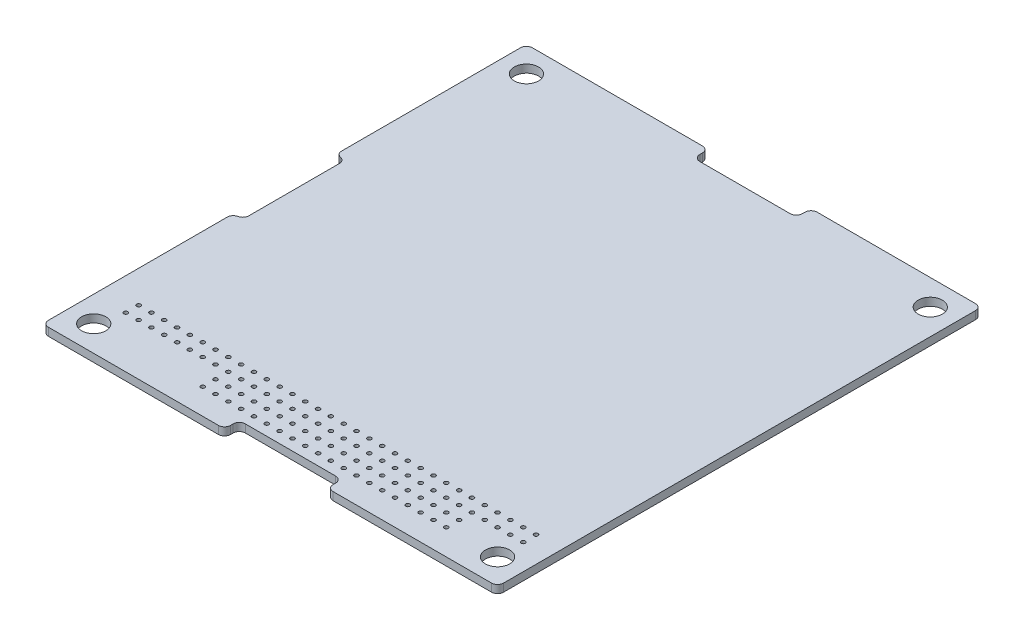
from build123d import *

# Parameters (mm, degrees)
SKETCH1_W           = 90.17
SKETCH1_H           = 95.89
BOSS_EXTRUDE1_DEPTH = 1.57
SKETCH2_W           = 20.32
SKETCH2_H           = 2.93
SKETCH2_W_2         = 1.92
SKETCH2_H_2         = 20.27
SKETCH2_H_3         = 2.92
CUT_EXTRUDE1_DEPTH  = 1.57
SKETCH3_R           = 2.4
CUT_EXTRUDE2_DEPTH  = 1.57
FILLET7_R           = 1.2
FILLET8_R           = 1.2
FILLET9_R           = 1.2
FILLET10_R          = 1.2
FILLET11_R          = 1.2
FILLET12_R          = 1.2
FILLET13_R          = 1.2
FILLET14_R          = 1.2
FILLET17_R          = 1.2
FILLET18_R          = 1.2
FILLET19_R          = 1.2
FILLET20_R          = 1.2
FILLET21_R          = 1.2
SKETCH11_R          = 0.4
CUT_EXTRUDE8_DEPTH  = 10
SKETCH12_R          = 0.4
CUT_EXTRUDE9_DEPTH  = 10
SKETCH13_R          = 0.4
CUT_EXTRUDE10_DEPTH = 10
SKETCH14_R          = 0.4
CUT_EXTRUDE11_DEPTH = 10


with BuildPart() as part:
    # Sketch1 → Boss-Extrude1 (new body)
    with BuildSketch(Plane(origin=(0, 0, 0), x_dir=(1, 0, 0), z_dir=(0, 1, 0))):
        Rectangle(SKETCH1_W, SKETCH1_H)
    extrude(amount=BOSS_EXTRUDE1_DEPTH)

    # Sketch2 → Cut-Extrude1 (cut)
    with BuildSketch(Plane(origin=(0, 1.57, 0), x_dir=(1, 0, 0), z_dir=(0, 1, 0))):
        with Locations((1.145, 46.48)):
            Rectangle(SKETCH2_W, SKETCH2_H)
        with Locations((-44.125, 0)):
            Rectangle(SKETCH2_W_2, SKETCH2_H_2)
        with Locations((1.145, -46.485)):
            Rectangle(SKETCH2_W, SKETCH2_H_3)
    extrude(amount=-CUT_EXTRUDE1_DEPTH, mode=Mode.SUBTRACT)

    # Sketch3 → Cut-Extrude2 (cut)
    with BuildSketch(Plane(origin=(0, 1.57, 0), x_dir=(1, 0, 0), z_dir=(0, 1, 0))):
        with Locations(Location((-40.005, -42.865, 0), (0, 0, 270))):
            Circle(SKETCH3_R)
        with Locations(Location((40.005, -42.865, 0), (0, 0, 270))):
            Circle(SKETCH3_R)
        with Locations(Location((-40.005, 42.865, 0), (0, 0, 270))):
            Circle(SKETCH3_R)
        with Locations(Location((40.005, 42.865, 0), (0, 0, 270))):
            Circle(SKETCH3_R)
    extrude(amount=-CUT_EXTRUDE2_DEPTH, mode=Mode.SUBTRACT)

    # Fillet7
    fillet7_edges = [part.edges().sort_by_distance(p)[0] for p in [
        (-9.015, 0.785, 45.025),
    ]]
    fillet(fillet7_edges, radius=FILLET7_R)

    # Fillet8
    fillet8_edges = [part.edges().sort_by_distance(p)[0] for p in [
        (-9.015, 0.785, 47.945),
    ]]
    fillet(fillet8_edges, radius=FILLET8_R)

    # Fillet9
    fillet9_edges = [part.edges().sort_by_distance(p)[0] for p in [
        (11.305, 0.785, 45.025),
        (11.305, 0.785, 47.945),
    ]]
    fillet(fillet9_edges, radius=FILLET9_R)

    # Fillet10
    fillet10_edges = [part.edges().sort_by_distance(p)[0] for p in [
        (45.085, 0.785, 47.945),
    ]]
    fillet(fillet10_edges, radius=FILLET10_R)

    # Fillet11
    fillet11_edges = [part.edges().sort_by_distance(p)[0] for p in [
        (45.085, 0.785, -47.945),
    ]]
    fillet(fillet11_edges, radius=FILLET11_R)

    # Fillet12
    fillet12_edges = [part.edges().sort_by_distance(p)[0] for p in [
        (11.305, 0.785, -47.945),
        (11.305, 0.785, -45.015),
    ]]
    fillet(fillet12_edges, radius=FILLET12_R)

    # Fillet13
    fillet13_edges = [part.edges().sort_by_distance(p)[0] for p in [
        (-9.015, 0.785, -45.015),
        (-9.015, 0.785, -47.945),
    ]]
    fillet(fillet13_edges, radius=FILLET13_R)

    # Fillet14
    fillet14_edges = [part.edges().sort_by_distance(p)[0] for p in [
        (-45.085, 0.785, -47.945),
    ]]
    fillet(fillet14_edges, radius=FILLET14_R)

    # Fillet17
    fillet17_edges = [part.edges().sort_by_distance(p)[0] for p in [
        (-45.085, 0.785, -10.135),
    ]]
    fillet(fillet17_edges, radius=FILLET17_R)

    # Fillet18
    fillet18_edges = [part.edges().sort_by_distance(p)[0] for p in [
        (-43.165, 0.785, -10.135),
    ]]
    fillet(fillet18_edges, radius=FILLET18_R)

    # Fillet19
    fillet19_edges = [part.edges().sort_by_distance(p)[0] for p in [
        (-45.085, 0.785, 10.135),
    ]]
    fillet(fillet19_edges, radius=FILLET19_R)

    # Fillet20
    fillet20_edges = [part.edges().sort_by_distance(p)[0] for p in [
        (-43.165, 0.785, 10.135),
    ]]
    fillet(fillet20_edges, radius=FILLET20_R)

    # Fillet21
    fillet21_edges = [part.edges().sort_by_distance(p)[0] for p in [
        (-45.085, 0.785, 47.945),
    ]]
    fillet(fillet21_edges, radius=FILLET21_R)

    # Sketch11 → Cut-Extrude8 (cut)
    with BuildSketch(Plane(origin=(0, 1.57, 0), x_dir=(1, 0, 0), z_dir=(0, 1, 0))):
        with Locations(Location((-38.735, -37.785, 0), (0, 0, 270))):
            Circle(SKETCH11_R)
        with Locations(Location((-36.195, -37.785, 0), (0, 0, 270))):
            Circle(SKETCH11_R)
        with Locations(Location((-33.655, -37.785, 0), (0, 0, 270))):
            Circle(SKETCH11_R)
        with Locations(Location((-31.115, -37.785, 0), (0, 0, 270))):
            Circle(SKETCH11_R)
        with Locations(Location((-28.575, -37.785, 0), (0, 0, 270))):
            Circle(SKETCH11_R)
        with Locations(Location((-26.035, -37.785, 0), (0, 0, 270))):
            Circle(SKETCH11_R)
        with Locations(Location((-23.495, -37.785, 0), (0, 0, 270))):
            Circle(SKETCH11_R)
        with Locations(Location((-20.955, -37.785, 0), (0, 0, 270))):
            Circle(SKETCH11_R)
        with Locations(Location((-18.415, -37.785, 0), (0, 0, 270))):
            Circle(SKETCH11_R)
        with Locations(Location((-15.875, -37.785, 0), (0, 0, 270))):
            Circle(SKETCH11_R)
        with Locations(Location((-13.335, -37.785, 0), (0, 0, 270))):
            Circle(SKETCH11_R)
        with Locations(Location((-10.795, -37.785, 0), (0, 0, 270))):
            Circle(SKETCH11_R)
        with Locations(Location((-8.255, -37.785, 0), (0, 0, 270))):
            Circle(SKETCH11_R)
        with Locations(Location((-5.715, -37.785, 0), (0, 0, 270))):
            Circle(SKETCH11_R)
        with Locations(Location((-3.175, -37.785, 0), (0, 0, 270))):
            Circle(SKETCH11_R)
        with Locations(Location((-0.635, -37.785, 0), (0, 0, 270))):
            Circle(SKETCH11_R)
        with Locations(Location((1.905, -37.785, 0), (0, 0, 270))):
            Circle(SKETCH11_R)
        with Locations(Location((4.445, -37.785, 0), (0, 0, 270))):
            Circle(SKETCH11_R)
        with Locations(Location((6.985, -37.785, 0), (0, 0, 270))):
            Circle(SKETCH11_R)
        with Locations(Location((9.525, -37.785, 0), (0, 0, 270))):
            Circle(SKETCH11_R)
        with Locations(Location((12.065, -37.785, 0), (0, 0, 270))):
            Circle(SKETCH11_R)
        with Locations(Location((14.605, -37.785, 0), (0, 0, 270))):
            Circle(SKETCH11_R)
        with Locations(Location((17.145, -37.785, 0), (0, 0, 270))):
            Circle(SKETCH11_R)
        with Locations(Location((19.685, -37.785, 0), (0, 0, 270))):
            Circle(SKETCH11_R)
        with Locations(Location((22.225, -37.785, 0), (0, 0, 270))):
            Circle(SKETCH11_R)
        with Locations(Location((24.765, -37.785, 0), (0, 0, 270))):
            Circle(SKETCH11_R)
        with Locations(Location((27.305, -37.785, 0), (0, 0, 270))):
            Circle(SKETCH11_R)
        with Locations(Location((29.845, -37.785, 0), (0, 0, 270))):
            Circle(SKETCH11_R)
        with Locations(Location((32.385, -37.785, 0), (0, 0, 270))):
            Circle(SKETCH11_R)
        with Locations(Location((34.925, -37.785, 0), (0, 0, 270))):
            Circle(SKETCH11_R)
        with Locations(Location((37.465, -37.785, 0), (0, 0, 270))):
            Circle(SKETCH11_R)
        with Locations(Location((40.005, -37.785, 0), (0, 0, 270))):
            Circle(SKETCH11_R)
    extrude(amount=-CUT_EXTRUDE8_DEPTH, mode=Mode.SUBTRACT)

    # Sketch12 → Cut-Extrude9 (cut)
    with BuildSketch(Plane(origin=(0, 1.57, 0), x_dir=(1, 0, 0), z_dir=(0, 1, 0))):
        with Locations(Location((-38.735, -35.245, 0), (0, 0, 270))):
            Circle(SKETCH12_R)
        with Locations(Location((-36.195, -35.245, 0), (0, 0, 270))):
            Circle(SKETCH12_R)
        with Locations(Location((-33.655, -35.245, 0), (0, 0, 270))):
            Circle(SKETCH12_R)
        with Locations(Location((-31.115, -35.245, 0), (0, 0, 270))):
            Circle(SKETCH12_R)
        with Locations(Location((-28.575, -35.245, 0), (0, 0, 270))):
            Circle(SKETCH12_R)
        with Locations(Location((-26.035, -35.245, 0), (0, 0, 270))):
            Circle(SKETCH12_R)
        with Locations(Location((-23.495, -35.245, 0), (0, 0, 270))):
            Circle(SKETCH12_R)
        with Locations(Location((-20.955, -35.245, 0), (0, 0, 270))):
            Circle(SKETCH12_R)
        with Locations(Location((-18.415, -35.245, 0), (0, 0, 270))):
            Circle(SKETCH12_R)
        with Locations(Location((-15.875, -35.245, 0), (0, 0, 270))):
            Circle(SKETCH12_R)
        with Locations(Location((-13.335, -35.245, 0), (0, 0, 270))):
            Circle(SKETCH12_R)
        with Locations(Location((-10.795, -35.245, 0), (0, 0, 270))):
            Circle(SKETCH12_R)
        with Locations(Location((-8.255, -35.245, 0), (0, 0, 270))):
            Circle(SKETCH12_R)
        with Locations(Location((-5.715, -35.245, 0), (0, 0, 270))):
            Circle(SKETCH12_R)
        with Locations(Location((-3.175, -35.245, 0), (0, 0, 270))):
            Circle(SKETCH12_R)
        with Locations(Location((-0.635, -35.245, 0), (0, 0, 270))):
            Circle(SKETCH12_R)
        with Locations(Location((1.905, -35.245, 0), (0, 0, 270))):
            Circle(SKETCH12_R)
        with Locations(Location((4.445, -35.245, 0), (0, 0, 270))):
            Circle(SKETCH12_R)
        with Locations(Location((6.985, -35.245, 0), (0, 0, 270))):
            Circle(SKETCH12_R)
        with Locations(Location((9.525, -35.245, 0), (0, 0, 270))):
            Circle(SKETCH12_R)
        with Locations(Location((12.065, -35.245, 0), (0, 0, 270))):
            Circle(SKETCH12_R)
        with Locations(Location((14.605, -35.245, 0), (0, 0, 270))):
            Circle(SKETCH12_R)
        with Locations(Location((17.145, -35.245, 0), (0, 0, 270))):
            Circle(SKETCH12_R)
        with Locations(Location((19.685, -35.245, 0), (0, 0, 270))):
            Circle(SKETCH12_R)
        with Locations(Location((22.225, -35.245, 0), (0, 0, 270))):
            Circle(SKETCH12_R)
        with Locations(Location((24.765, -35.245, 0), (0, 0, 270))):
            Circle(SKETCH12_R)
        with Locations(Location((27.305, -35.245, 0), (0, 0, 270))):
            Circle(SKETCH12_R)
        with Locations(Location((29.845, -35.245, 0), (0, 0, 270))):
            Circle(SKETCH12_R)
        with Locations(Location((32.385, -35.245, 0), (0, 0, 270))):
            Circle(SKETCH12_R)
        with Locations(Location((34.925, -35.245, 0), (0, 0, 270))):
            Circle(SKETCH12_R)
        with Locations(Location((37.465, -35.245, 0), (0, 0, 270))):
            Circle(SKETCH12_R)
        with Locations(Location((40.005, -35.245, 0), (0, 0, 270))):
            Circle(SKETCH12_R)
    extrude(amount=-CUT_EXTRUDE9_DEPTH, mode=Mode.SUBTRACT)

    # Sketch13 → Cut-Extrude10 (cut)
    with BuildSketch(Plane(origin=(0, 1.57, 0), x_dir=(1, 0, 0), z_dir=(0, 1, 0))):
        with Locations(Location((-18.415, -42.865, 0), (0, 0, 270))):
            Circle(SKETCH13_R)
        with Locations(Location((-15.875, -42.865, 0), (0, 0, 270))):
            Circle(SKETCH13_R)
        with Locations(Location((-13.335, -42.865, 0), (0, 0, 270))):
            Circle(SKETCH13_R)
        with Locations(Location((-10.795, -42.865, 0), (0, 0, 270))):
            Circle(SKETCH13_R)
        with Locations(Location((-8.255, -42.865, 0), (0, 0, 270))):
            Circle(SKETCH13_R)
        with Locations(Location((-5.715, -42.865, 0), (0, 0, 270))):
            Circle(SKETCH13_R)
        with Locations(Location((-3.175, -42.865, 0), (0, 0, 270))):
            Circle(SKETCH13_R)
        with Locations(Location((-0.635, -42.865, 0), (0, 0, 270))):
            Circle(SKETCH13_R)
        with Locations(Location((1.905, -42.865, 0), (0, 0, 270))):
            Circle(SKETCH13_R)
        with Locations(Location((4.445, -42.865, 0), (0, 0, 270))):
            Circle(SKETCH13_R)
        with Locations(Location((6.985, -42.865, 0), (0, 0, 270))):
            Circle(SKETCH13_R)
        with Locations(Location((9.525, -42.865, 0), (0, 0, 270))):
            Circle(SKETCH13_R)
        with Locations(Location((12.065, -42.865, 0), (0, 0, 270))):
            Circle(SKETCH13_R)
        with Locations(Location((14.605, -42.865, 0), (0, 0, 270))):
            Circle(SKETCH13_R)
        with Locations(Location((17.145, -42.865, 0), (0, 0, 270))):
            Circle(SKETCH13_R)
        with Locations(Location((19.685, -42.865, 0), (0, 0, 270))):
            Circle(SKETCH13_R)
        with Locations(Location((22.225, -42.865, 0), (0, 0, 270))):
            Circle(SKETCH13_R)
        with Locations(Location((24.765, -42.865, 0), (0, 0, 270))):
            Circle(SKETCH13_R)
        with Locations(Location((27.305, -42.865, 0), (0, 0, 270))):
            Circle(SKETCH13_R)
        with Locations(Location((29.845, -42.865, 0), (0, 0, 270))):
            Circle(SKETCH13_R)
    extrude(amount=-CUT_EXTRUDE10_DEPTH, mode=Mode.SUBTRACT)

    # Sketch14 → Cut-Extrude11 (cut)
    with BuildSketch(Plane(origin=(0, 1.57, 0), x_dir=(1, 0, 0), z_dir=(0, 1, 0))):
        with Locations(Location((-18.415, -40.325, 0), (0, 0, 270))):
            Circle(SKETCH14_R)
        with Locations(Location((-15.875, -40.325, 0), (0, 0, 270))):
            Circle(SKETCH14_R)
        with Locations(Location((-13.335, -40.325, 0), (0, 0, 270))):
            Circle(SKETCH14_R)
        with Locations(Location((-10.795, -40.325, 0), (0, 0, 270))):
            Circle(SKETCH14_R)
        with Locations(Location((-8.255, -40.325, 0), (0, 0, 270))):
            Circle(SKETCH14_R)
        with Locations(Location((-5.715, -40.325, 0), (0, 0, 270))):
            Circle(SKETCH14_R)
        with Locations(Location((-3.175, -40.325, 0), (0, 0, 270))):
            Circle(SKETCH14_R)
        with Locations(Location((-0.635, -40.325, 0), (0, 0, 270))):
            Circle(SKETCH14_R)
        with Locations(Location((1.905, -40.325, 0), (0, 0, 270))):
            Circle(SKETCH14_R)
        with Locations(Location((4.445, -40.325, 0), (0, 0, 270))):
            Circle(SKETCH14_R)
        with Locations(Location((6.985, -40.325, 0), (0, 0, 270))):
            Circle(SKETCH14_R)
        with Locations(Location((9.525, -40.325, 0), (0, 0, 270))):
            Circle(SKETCH14_R)
        with Locations(Location((12.065, -40.325, 0), (0, 0, 270))):
            Circle(SKETCH14_R)
        with Locations(Location((14.605, -40.325, 0), (0, 0, 270))):
            Circle(SKETCH14_R)
        with Locations(Location((17.145, -40.325, 0), (0, 0, 270))):
            Circle(SKETCH14_R)
        with Locations(Location((19.685, -40.325, 0), (0, 0, 270))):
            Circle(SKETCH14_R)
        with Locations(Location((22.225, -40.325, 0), (0, 0, 270))):
            Circle(SKETCH14_R)
        with Locations(Location((24.765, -40.325, 0), (0, 0, 270))):
            Circle(SKETCH14_R)
        with Locations(Location((27.305, -40.325, 0), (0, 0, 270))):
            Circle(SKETCH14_R)
        with Locations(Location((29.845, -40.325, 0), (0, 0, 270))):
            Circle(SKETCH14_R)
    extrude(amount=-CUT_EXTRUDE11_DEPTH, mode=Mode.SUBTRACT)


solid = part.part
